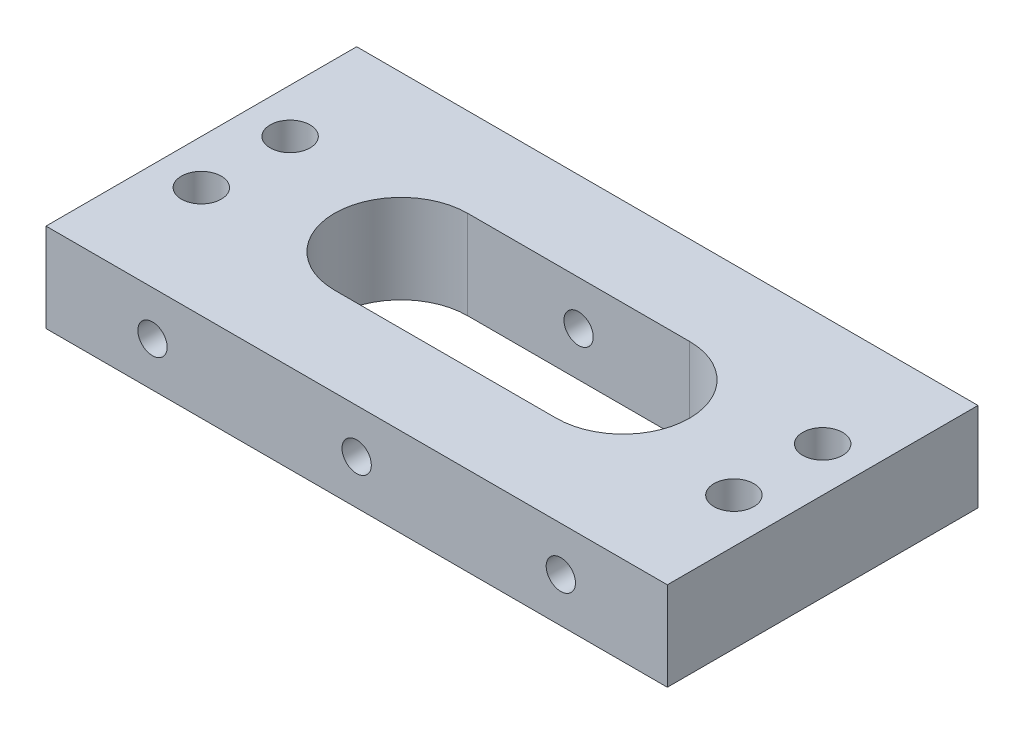
from build123d import *

# Parameters (mm, degrees)
SKETCH1_W           = 70
SKETCH1_H           = 35
BOSS_EXTRUDE1_DEPTH = 10
SKETCH2_R           = 1.65
CUT_EXTRUDE1_DEPTH  = 10
CUT_EXTRUDE2_DEPTH  = 10
SKETCH4_R           = 2.25
CUT_EXTRUDE3_DEPTH  = 10


with BuildPart() as part:
    # Sketch1 → Boss-Extrude1 (new body)
    with BuildSketch(Plane(origin=(0, 0, 0), x_dir=(1, 0, 0), z_dir=(0, 1, 0))):
        Rectangle(SKETCH1_W, SKETCH1_H)
    extrude(amount=BOSS_EXTRUDE1_DEPTH)

    # Sketch2 → Cut-Extrude1 (cut)
    with BuildSketch(Plane.XY.offset(17.5)):
        with Locations((-23, 5)):
            Circle(SKETCH2_R)
        with Locations((0, 5)):
            Circle(SKETCH2_R)
        with Locations(Location((23, 5, 0), (0, 0, 180))):
            Circle(SKETCH2_R)
    cut_extrude1 = extrude(amount=-CUT_EXTRUDE1_DEPTH, mode=Mode.SUBTRACT)

    # Sketch3 → Cut-Extrude2 (cut)
    with BuildSketch(Plane(origin=(0, 10, 0), x_dir=(1, 0, 0), z_dir=(0, 1, 0))):
        with BuildLine():
            Line((-12.5, 7.5), (12.5, 7.5))
            ThreePointArc((12.5, 7.5), (20, 0), (12.5, -7.5))
            Line((12.5, -7.5), (-12.5, -7.5))
            ThreePointArc((-12.5, -7.5), (-20, 0), (-12.5, 7.5))
        make_face()
    extrude(amount=-CUT_EXTRUDE2_DEPTH, mode=Mode.SUBTRACT)

    # Sketch4 → Cut-Extrude3 (cut)
    with BuildSketch(Plane(origin=(0, 10, 0), x_dir=(1, 0, 0), z_dir=(0, 1, 0))):
        with Locations(Location((-30, -5, 0), (0, 0, 270))):
            Circle(SKETCH4_R)
        with Locations(Location((-30, 5, 0), (0, 0, 90))):
            Circle(SKETCH4_R)
        with Locations(Location((30, -5, 0), (0, 0, 90))):
            Circle(SKETCH4_R)
        with Locations(Location((30, 5, 0), (0, 0, 270))):
            Circle(SKETCH4_R)
    extrude(amount=-CUT_EXTRUDE3_DEPTH, mode=Mode.SUBTRACT)

    # Mirror1: Cut-Extrude1 across plane
    add(cut_extrude1.mirror(Plane.XY), mode=Mode.SUBTRACT)


solid = part.part
